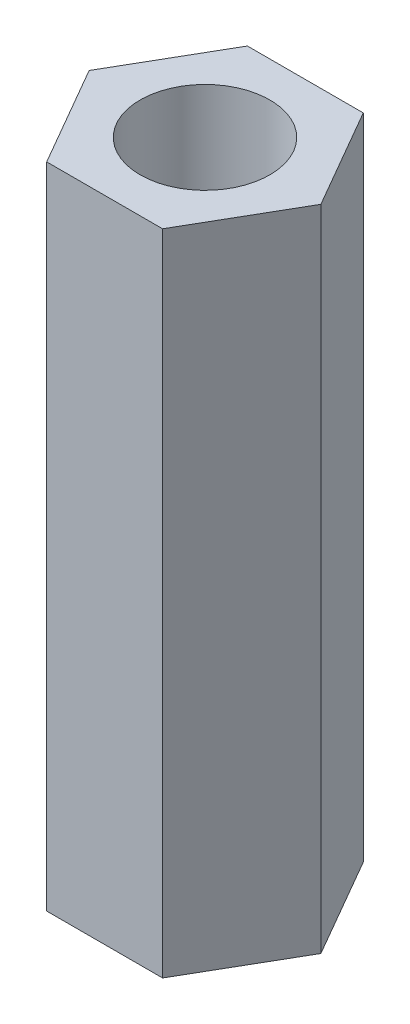
from build123d import *

# Parameters (mm, degrees)
SKETCH1_R           = 1.5
BOSS_EXTRUDE1_DEPTH = 7.5


with BuildPart() as part:
    # Sketch1 → Boss-Extrude1 (new, symmetric)
    with BuildSketch(Plane(origin=(0, 0, 0), x_dir=(1, 0, 0), z_dir=(0, 1, 0))):
        Polygon((2.678905249, 0), (1.339452625, 2.32), (-1.339452625, 2.32), (-2.678905249, 0), (-1.339452625, -2.32), (1.339452625, -2.32), align=None)
        with Locations(Location((0, 0, 0), (0, 0, 270))):
            Circle(SKETCH1_R, mode=Mode.SUBTRACT)
    extrude(amount=BOSS_EXTRUDE1_DEPTH, both=True)


solid = part.part
